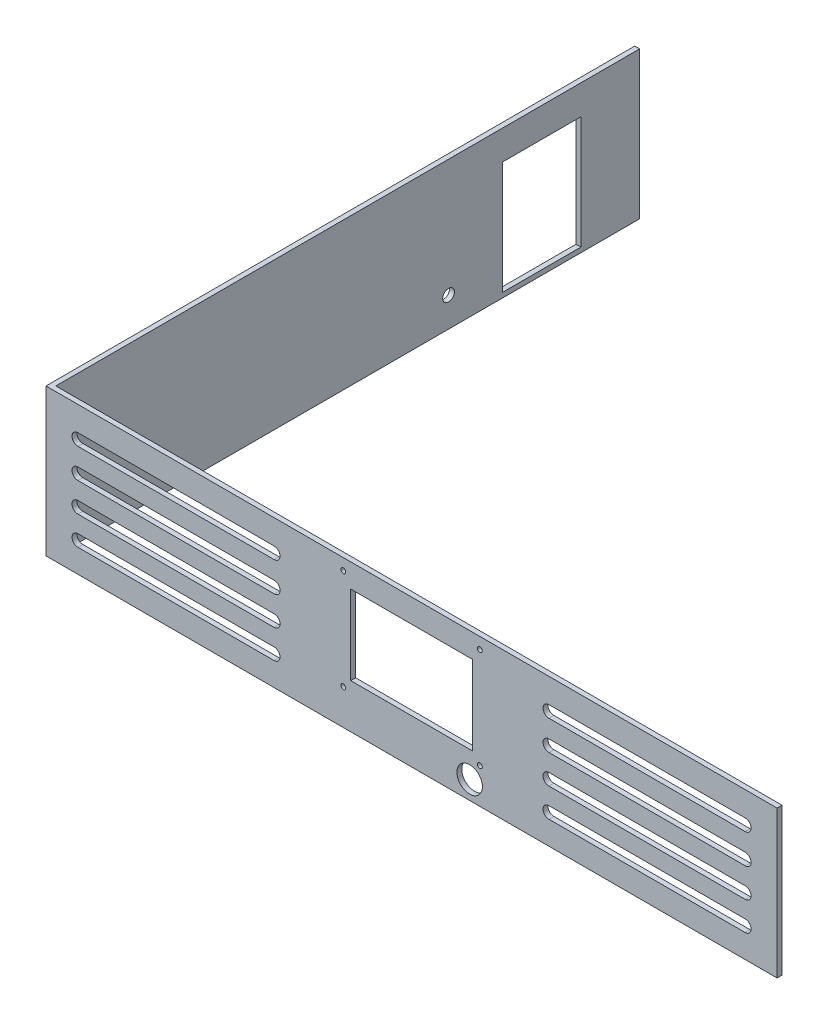
from build123d import *

# Parameters (mm, degrees)
SKETCH1_W           = 473.075
SKETCH1_H           = 95.25
BOSS_EXTRUDE1_DEPTH = 3.175
SKETCH3_W           = 78.74
SKETCH3_H           = 51.308
CUT_EXTRUDE2_DEPTH  = 242.305221983
SKETCH4_R           = 8.255
CUT_EXTRUDE3_DEPTH  = 242.305221983
SKETCH5_R           = 1.5875
CUT_EXTRUDE4_DEPTH  = 242.305221983
SKETCH6_W           = 3.175
SKETCH6_H           = 95.25
BOSS_EXTRUDE2_DEPTH = 377.825
SKETCH7_R           = 3.81
SKETCH7_W           = 50.8
SKETCH7_H           = 73.025
CUT_EXTRUDE5_DEPTH  = 381
CUT_EXTRUDE6_DEPTH  = 381


with BuildPart() as part:
    # Sketch1 → Boss-Extrude1 (new body)
    with BuildSketch(Plane.XY):
        Rectangle(SKETCH1_W, SKETCH1_H)
    extrude(amount=BOSS_EXTRUDE1_DEPTH)

    # Sketch3 → Cut-Extrude2 (cut, through all)
    with BuildSketch(Plane.XY.offset(3.175)):
        with Locations((0, 6.731)):
            Rectangle(SKETCH3_W, SKETCH3_H)
    extrude(amount=-CUT_EXTRUDE2_DEPTH, mode=Mode.SUBTRACT)

    # Sketch4 → Cut-Extrude3 (cut, through all)
    with BuildSketch(Plane.XY.offset(3.175)):
        with Locations((37.592, -35.814)):
            Circle(SKETCH4_R)
    extrude(amount=-CUT_EXTRUDE3_DEPTH, mode=Mode.SUBTRACT)

    # Sketch5 → Cut-Extrude4 (cut, through all)
    with BuildSketch(Plane.XY.offset(3.175)):
        with Locations((44.196, 40.259)):
            Circle(SKETCH5_R)
        with Locations((44.196, -24.765)):
            Circle(SKETCH5_R)
        with Locations((-44.196, -24.765)):
            Circle(SKETCH5_R)
        with Locations((-44.196, 40.259)):
            Circle(SKETCH5_R)
    extrude(amount=-CUT_EXTRUDE4_DEPTH, mode=Mode.SUBTRACT)

    # Sketch6 → Boss-Extrude2 (add)
    with BuildSketch(Plane(origin=(0, 0, 0), x_dir=(-1, 0, 0), z_dir=(0, 0, -1))):
        with Locations((234.95, 0)):
            Rectangle(SKETCH6_W, SKETCH6_H)
    extrude(amount=BOSS_EXTRUDE2_DEPTH)

    # Sketch7 → Cut-Extrude5 (cut)
    with BuildSketch(Plane.ZY.offset(236.5375)):
        with Locations((-254.127, -28.575)):
            Circle(SKETCH7_R)
        with Locations((-314.325, -7.9375)):
            Rectangle(SKETCH7_W, SKETCH7_H)
    extrude(amount=-CUT_EXTRUDE5_DEPTH, mode=Mode.SUBTRACT)

    # Sketch8 → Cut-Extrude6 (cut)
    with BuildSketch(Plane.XY.offset(3.175)):
        with BuildLine():
            Line((215.9, 31.75), (88.9, 31.75))
            ThreePointArc((88.9, 31.75), (85.09, 27.94), (88.9, 24.13))
            Line((88.9, 24.13), (215.9, 24.13))
            ThreePointArc((215.9, 24.13), (219.71, 27.94), (215.9, 31.75))
        make_face()
        with BuildLine():
            Line((215.9, 12.563594852), (88.9, 12.563594852))
            ThreePointArc((88.9, 12.563594852), (85.09, 8.753594852), (88.9, 4.943594852))
            Line((88.9, 4.943594852), (215.9, 4.943594852))
            ThreePointArc((215.9, 4.943594852), (219.71, 8.753594852), (215.9, 12.563594852))
        make_face()
        with BuildLine():
            Line((215.9, -6.256272006), (88.9, -6.256272006))
            ThreePointArc((88.9, -6.256272006), (85.09, -10.066272006), (88.9, -13.876272006))
            Line((88.9, -13.876272006), (215.9, -13.876272006))
            ThreePointArc((215.9, -13.876272006), (219.71, -10.066272006), (215.9, -6.256272006))
        make_face()
        with BuildLine():
            Line((215.9, -24.84600572), (88.9, -24.84600572))
            ThreePointArc((88.9, -24.84600572), (85.09, -28.65600572), (88.9, -32.46600572))
            Line((88.9, -32.46600572), (215.9, -32.46600572))
            ThreePointArc((215.9, -32.46600572), (219.71, -28.65600572), (215.9, -24.84600572))
        make_face()
        with BuildLine():
            ThreePointArc((-88.9, -32.46600572), (-85.09, -28.65600572), (-88.9, -24.84600572))
            Line((-88.9, -24.84600572), (-215.9, -24.84600572))
            ThreePointArc((-215.9, -24.84600572), (-219.71, -28.65600572), (-215.9, -32.46600572))
            Line((-215.9, -32.46600572), (-88.9, -32.46600572))
        make_face()
        with BuildLine():
            ThreePointArc((-88.9, -13.876272006), (-85.09, -10.066272006), (-88.9, -6.256272006))
            Line((-88.9, -6.256272006), (-215.9, -6.256272006))
            ThreePointArc((-215.9, -6.256272006), (-219.71, -10.066272006), (-215.9, -13.876272006))
            Line((-215.9, -13.876272006), (-88.9, -13.876272006))
        make_face()
        with BuildLine():
            ThreePointArc((-88.9, 4.943594852), (-85.09, 8.753594852), (-88.9, 12.563594852))
            Line((-88.9, 12.563594852), (-215.9, 12.563594852))
            ThreePointArc((-215.9, 12.563594852), (-219.71, 8.753594852), (-215.9, 4.943594852))
            Line((-215.9, 4.943594852), (-88.9, 4.943594852))
        make_face()
        with BuildLine():
            ThreePointArc((-88.9, 24.13), (-85.09, 27.94), (-88.9, 31.75))
            Line((-88.9, 31.75), (-215.9, 31.75))
            ThreePointArc((-215.9, 31.75), (-219.71, 27.94), (-215.9, 24.13))
            Line((-215.9, 24.13), (-88.9, 24.13))
        make_face()
    extrude(amount=-CUT_EXTRUDE6_DEPTH, mode=Mode.SUBTRACT)


solid = part.part
